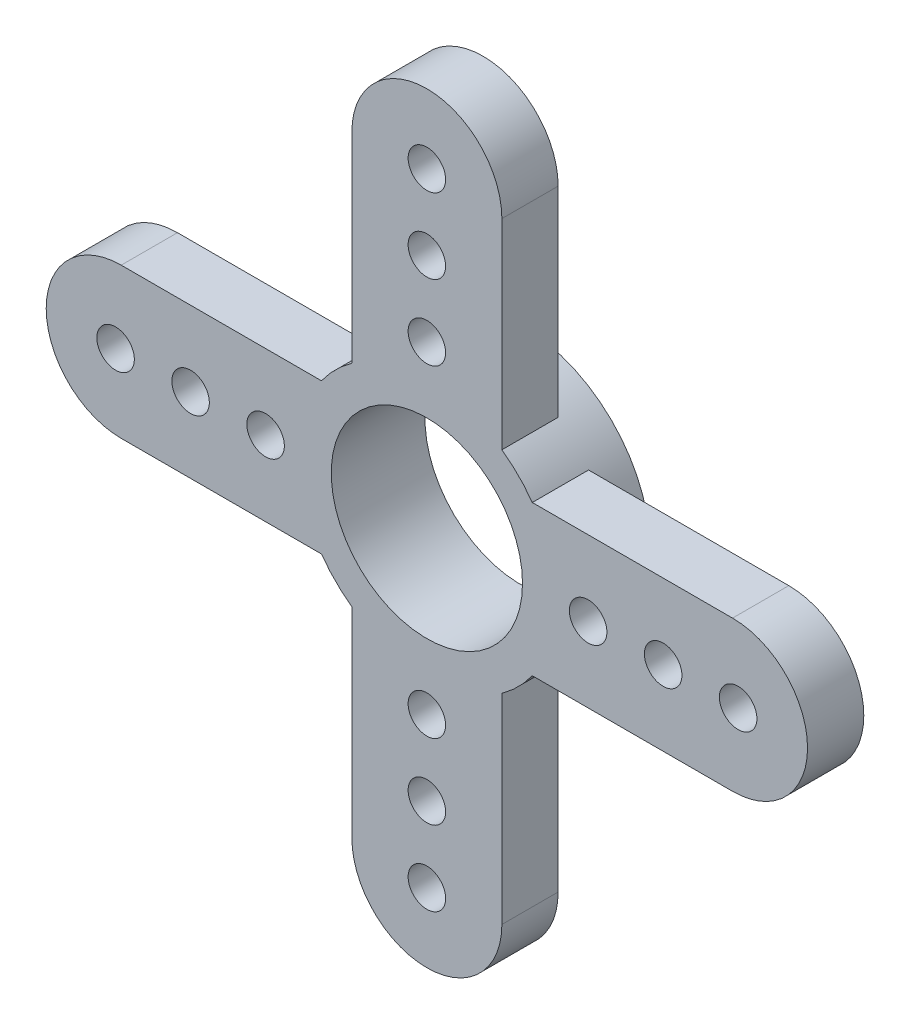
from build123d import *

# Parameters (mm, degrees)
COMPACT_HORN_CENTER_OD6P9_PROFILE_R        = 3.45
COMPACT_HORN_CENTER_OD6P9_DEPTH            = 1.5
HORIZONTAL_BLADES_ASSUMED_WIDTH4_PROFILE_W = 16.3
HORIZONTAL_BLADES_ASSUMED_WIDTH4_PROFILE_H = 4
HORIZONTAL_BLADES_ASSUMED_WIDTH4_DEPTH     = 1.5
VERTICAL_BLADES_ASSUMED_WIDTH4_PROFILE_W   = 4
VERTICAL_BLADES_ASSUMED_WIDTH4_PROFILE_H   = 16.3
VERTICAL_BLADES_ASSUMED_WIDTH4_DEPTH       = 1.5
ROUNDED_BLADE_TIPS_R                       = 2
ROUNDED_TIPS_SPAN20P3_DEPTH                = 1.5
HUB_TOTAL_HEIGHT2P5_START                  = -1
HUB_TOTAL_HEIGHT2P5_PROFILE_R              = 3.45
HUB_TOTAL_HEIGHT2P5_DEPTH                  = 1
PURCHASED_SPLINE_INTERNALS_OMITTED_START   = -50
PURCHASED_SPLINE_INTERNALS_OMITTED_PROFI_R = 2.55
PURCHASED_SPLINE_INTERNALS_OMITTED_DEPTH   = 65.432428763
UNMODIFIED_STOCK_PILOT_HOLES_START         = -50
UNMODIFIED_STOCK_PILOT_HOLES_PROFILE_R     = 0.5
UNMODIFIED_STOCK_PILOT_HOLES_DEPTH         = 65.432428763


with BuildPart() as part:
    # Compact_horn_center_OD6p9_profile → Compact_horn_center_OD6p9 (new body)
    with BuildSketch(Plane.XY):
        Circle(COMPACT_HORN_CENTER_OD6P9_PROFILE_R)
    extrude(amount=COMPACT_HORN_CENTER_OD6P9_DEPTH)

    # Horizontal_blades_assumed_width4_profile → Horizontal_blades_assumed_width4 (add)
    with BuildSketch(Plane.XY):
        Rectangle(HORIZONTAL_BLADES_ASSUMED_WIDTH4_PROFILE_W, HORIZONTAL_BLADES_ASSUMED_WIDTH4_PROFILE_H)
    extrude(amount=HORIZONTAL_BLADES_ASSUMED_WIDTH4_DEPTH)

    # Vertical_blades_assumed_width4_profile → Vertical_blades_assumed_width4 (add)
    with BuildSketch(Plane.XY):
        Rectangle(VERTICAL_BLADES_ASSUMED_WIDTH4_PROFILE_W, VERTICAL_BLADES_ASSUMED_WIDTH4_PROFILE_H)
    extrude(amount=VERTICAL_BLADES_ASSUMED_WIDTH4_DEPTH)

    # Rounded_blade_tips → Rounded_tips_span20p3 (add)
    with BuildSketch(Plane.XY):
        with Locations((8.15, 0)):
            Circle(ROUNDED_BLADE_TIPS_R)
        with Locations((-8.15, 0)):
            Circle(ROUNDED_BLADE_TIPS_R)
        with Locations((0, 8.15)):
            Circle(ROUNDED_BLADE_TIPS_R)
        with Locations((0, -8.15)):
            Circle(ROUNDED_BLADE_TIPS_R)
    extrude(amount=ROUNDED_TIPS_SPAN20P3_DEPTH)

    # Hub_total_height2p5_profile → Hub_total_height2p5 (add)
    with BuildSketch(Plane.XY.offset(HUB_TOTAL_HEIGHT2P5_START)):
        with Locations(Location((0, 0, 0), (0, 0, 215.43015836))):
            Circle(HUB_TOTAL_HEIGHT2P5_PROFILE_R)
    extrude(amount=HUB_TOTAL_HEIGHT2P5_DEPTH)

    # Purchased_spline_internals_omitted_profile → Purchased_spline_internals_omitted (cut, through all)
    with BuildSketch(Plane.XY.offset(PURCHASED_SPLINE_INTERNALS_OMITTED_START)):
        Circle(PURCHASED_SPLINE_INTERNALS_OMITTED_PROFI_R)
    extrude(amount=PURCHASED_SPLINE_INTERNALS_OMITTED_DEPTH, mode=Mode.SUBTRACT)

    # Unmodified_stock_pilot_holes_profile → Unmodified_stock_pilot_holes (cut, through all)
    with BuildSketch(Plane.XY.offset(UNMODIFIED_STOCK_PILOT_HOLES_START)):
        with Locations((-8.3, 0)):
            Circle(UNMODIFIED_STOCK_PILOT_HOLES_PROFILE_R)
        with Locations((-6.3, 0)):
            Circle(UNMODIFIED_STOCK_PILOT_HOLES_PROFILE_R)
        with Locations((-4.3, 0)):
            Circle(UNMODIFIED_STOCK_PILOT_HOLES_PROFILE_R)
        with Locations((4.3, 0)):
            Circle(UNMODIFIED_STOCK_PILOT_HOLES_PROFILE_R)
        with Locations((6.3, 0)):
            Circle(UNMODIFIED_STOCK_PILOT_HOLES_PROFILE_R)
        with Locations((8.3, 0)):
            Circle(UNMODIFIED_STOCK_PILOT_HOLES_PROFILE_R)
        with Locations((0, -8.3)):
            Circle(UNMODIFIED_STOCK_PILOT_HOLES_PROFILE_R)
        with Locations((0, -6.3)):
            Circle(UNMODIFIED_STOCK_PILOT_HOLES_PROFILE_R)
        with Locations((0, -4.3)):
            Circle(UNMODIFIED_STOCK_PILOT_HOLES_PROFILE_R)
        with Locations((0, 4.3)):
            Circle(UNMODIFIED_STOCK_PILOT_HOLES_PROFILE_R)
        with Locations((0, 6.3)):
            Circle(UNMODIFIED_STOCK_PILOT_HOLES_PROFILE_R)
        with Locations((0, 8.3)):
            Circle(UNMODIFIED_STOCK_PILOT_HOLES_PROFILE_R)
    extrude(amount=UNMODIFIED_STOCK_PILOT_HOLES_DEPTH, mode=Mode.SUBTRACT)


solid = part.part
